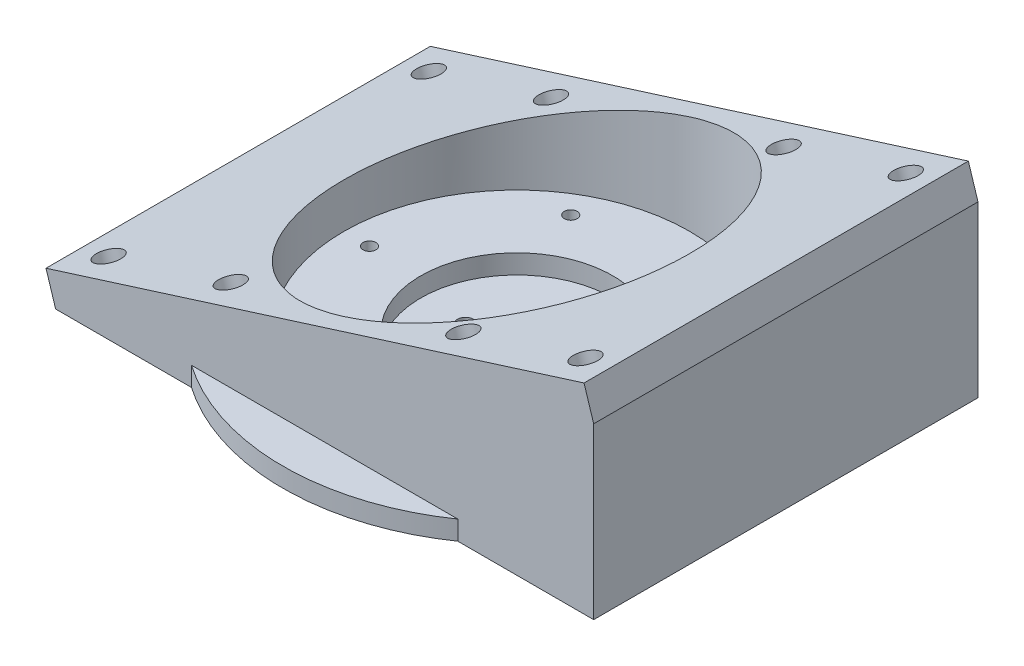
from build123d import *

# Parameters (mm, degrees)
EXTRUDE_1_DEPTH          = 60
SKETCH_2_W               = 88.076446511
SKETCH_2_H               = 60
EXTRUDE_2_DEPTH          = 5
SKETCH_3_R               = 27
CUT_EXTRUDE_1_DEPTH      = 50
SKETCH_4_R               = 36.5
EXTRUDE_3_DEPTH          = 3
SKETCH_13_R              = 20
CUT_EXTRUDE_3_DEPTH      = 60
SKETCH_14_R              = 1
CUT_EXTRUDE_4_DEPTH      = 60
PATTERN_CIRCULAR_1_COUNT = 6
SKETCH_16_R              = 2
CUT_EXTRUDE_5_DEPTH      = 3
PATTERN_LINEAR_1_COUNT   = 2
PATTERN_LINEAR_1_PITCH   = 20
SKETCH_17_R              = 2
CUT_EXTRUDE_6_DEPTH      = 3
PATTERN_LINEAR_2_COUNT   = 2
PATTERN_LINEAR_2_PITCH   = 20
SKETCH_18_R              = 20
EXTRUDE_4_DEPTH          = 6
SKETCH_19_R              = 6
CUT_EXTRUDE_7_DEPTH      = 6
SKETCH_20_R              = 15
CUT_EXTRUDE_8_DEPTH      = 3
SKETCH_21_R              = 1.25
CUT_EXTRUDE_9_DEPTH      = 3
PATTERN_CIRCULAR_2_COUNT = 4


with BuildPart() as part:
    # 草图1 → 凸台-拉伸1 (new body)
    with BuildSketch(Plane.XY):
        Polygon((-67.082379863, -7.957665904), (16.917620137, -7.957665904), (16.917620137, 18.527432362), align=None)
    extrude(amount=EXTRUDE_1_DEPTH)

    # 草图2 → 凸台-拉伸2 (add)
    with BuildSketch(Plane(origin=(-3.783690806, 12.000334093, 0), x_dir=(0.9537169507482267, 0.30070579950427384, 0), z_dir=(-0.30070579950427384, 0.9537169507482267, 0))):
        with Locations((-22.332295804, -30)):
            Rectangle(SKETCH_2_W, SKETCH_2_H)
    extrude(amount=EXTRUDE_2_DEPTH)

    # 草图3 → 切除-拉伸1 (cut)
    with BuildSketch(Plane(origin=(0, -7.957665904, 0), x_dir=(-1, 0, 0), z_dir=(0, -1, 0))):
        with Locations(Location((25.082379863, -30, 0), (0, 0, 90))):
            Circle(SKETCH_3_R)
    extrude(amount=-CUT_EXTRUDE_1_DEPTH, mode=Mode.SUBTRACT)

    # 草图4 → 凸台-拉伸3 (add)
    with BuildSketch(Plane(origin=(0, -7.957665904, 0), x_dir=(-1, 0, 0), z_dir=(0, -1, 0))):
        with Locations((25.082379863, -30)):
            Circle(SKETCH_4_R)
    extrude(amount=-EXTRUDE_3_DEPTH)

    # 草图13 → 切除-拉伸3 (cut)
    with BuildSketch(Plane(origin=(0, -4.957665904, 0), x_dir=(1, 0, 0), z_dir=(0, 1, 0))):
        with Locations(Location((-25.082379863, -30, 0), (0, 0, 270))):
            Circle(SKETCH_13_R)
    extrude(amount=-CUT_EXTRUDE_3_DEPTH, mode=Mode.SUBTRACT)

    # 草图14 → 切除-拉伸4 (cut)
    with BuildSketch(Plane(origin=(0, -4.957665904, 0), x_dir=(1, 0, 0), z_dir=(0, 1, 0))):
        with Locations(Location((-48.082379863, -30, 0), (0, 0, 270))):
            Circle(SKETCH_14_R)
    cut_extrude_4 = extrude(amount=-CUT_EXTRUDE_4_DEPTH, mode=Mode.SUBTRACT)

    # 阵列(圆周)1: 切除-拉伸4 ×6 about axis
    pattern_circular_1_axis = Axis((-25.082379863, 0, 30), (0, 1, 0))
    for i in range(1, PATTERN_CIRCULAR_1_COUNT):
        add(cut_extrude_4.rotate(pattern_circular_1_axis, i * 360 / PATTERN_CIRCULAR_1_COUNT), mode=Mode.SUBTRACT)

    # 草图16 → 切除-拉伸5 (cut)
    with BuildSketch(Plane(origin=(-5.287219803, 16.768918847, 0), x_dir=(0.9537169507482267, 0.3007057995042738, 0), z_dir=(-0.3007057995042738, 0.9537169507482267, 0))):
        with Locations(Location((-61.370519059, -5, 0), (0, 0, 180))):
            Circle(SKETCH_16_R)
        with Locations(Location((-61.370519059, -55, 0), (0, 0, 180))):
            Circle(SKETCH_16_R)
    cut_extrude_5 = extrude(amount=-CUT_EXTRUDE_5_DEPTH, mode=Mode.SUBTRACT)

    # 阵列(线性)1: 切除-拉伸5 ×2
    with Locations(*[Vector(0.9537169507482268, 0.3007057995042739, 0) * (i * PATTERN_LINEAR_1_PITCH) for i in range(1, PATTERN_LINEAR_1_COUNT)]):
        add(cut_extrude_5, mode=Mode.SUBTRACT)

    # 草图17 → 切除-拉伸6 (cut)
    with BuildSketch(Plane(origin=(-5.287219803, 16.768918847, 0), x_dir=(0.9537169507482267, 0.3007057995042738, 0), z_dir=(-0.3007057995042738, 0.9537169507482267, 0))):
        with Locations(Location((16.705927452, -55, 0), (0, 0, 180))):
            Circle(SKETCH_17_R)
        with Locations(Location((16.705927452, -5, 0), (0, 0, 180))):
            Circle(SKETCH_17_R)
    cut_extrude_6 = extrude(amount=-CUT_EXTRUDE_6_DEPTH, mode=Mode.SUBTRACT)

    # 阵列(线性)2: 切除-拉伸6 ×2
    with Locations(*[Vector(-0.9537169507482268, -0.30070579950427384, 0) * (i * PATTERN_LINEAR_2_PITCH) for i in range(1, PATTERN_LINEAR_2_COUNT)]):
        add(cut_extrude_6, mode=Mode.SUBTRACT)

    # 草图18 → 凸台-拉伸4 (add)
    with BuildSketch(Plane(origin=(0, -4.957665904, 0), x_dir=(1, 0, 0), z_dir=(0, 1, 0))):
        with Locations(Location((-25.082379863, -30, 0), (0, 0, 270))):
            Circle(SKETCH_18_R)
    extrude(amount=-EXTRUDE_4_DEPTH)

    # 草图19 → 切除-拉伸7 (cut)
    with BuildSketch(Plane(origin=(0, -4.957665904, 0), x_dir=(1, 0, 0), z_dir=(0, 1, 0))):
        with Locations(Location((-25.082379863, -30, 0), (0, 0, 270))):
            Circle(SKETCH_19_R)
    extrude(amount=-CUT_EXTRUDE_7_DEPTH, mode=Mode.SUBTRACT)

    # 草图20 → 切除-拉伸8 (cut)
    with BuildSketch(Plane(origin=(0, -4.957665904, 0), x_dir=(1, 0, 0), z_dir=(0, 1, 0))):
        with Locations(Location((-25.082379863, -30, 0), (0, 0, 270))):
            Circle(SKETCH_20_R)
    extrude(amount=-CUT_EXTRUDE_8_DEPTH, mode=Mode.SUBTRACT)

    # 草图21 → 切除-拉伸9 (cut)
    with BuildSketch(Plane(origin=(0, -7.957665904, 0), x_dir=(1, 0, 0), z_dir=(0, 1, 0))):
        with Locations(Location((-33.082379863, -30, 0), (0, 0, 270))):
            Circle(SKETCH_21_R)
    cut_extrude_9 = extrude(amount=-CUT_EXTRUDE_9_DEPTH, mode=Mode.SUBTRACT)

    # 阵列(圆周)2: 切除-拉伸9 ×4 about axis
    pattern_circular_2_axis = Axis((-25.082379863, 0, 30), (0, 1, 0))
    for i in range(1, PATTERN_CIRCULAR_2_COUNT):
        add(cut_extrude_9.rotate(pattern_circular_2_axis, i * 360 / PATTERN_CIRCULAR_2_COUNT), mode=Mode.SUBTRACT)


solid = part.part
